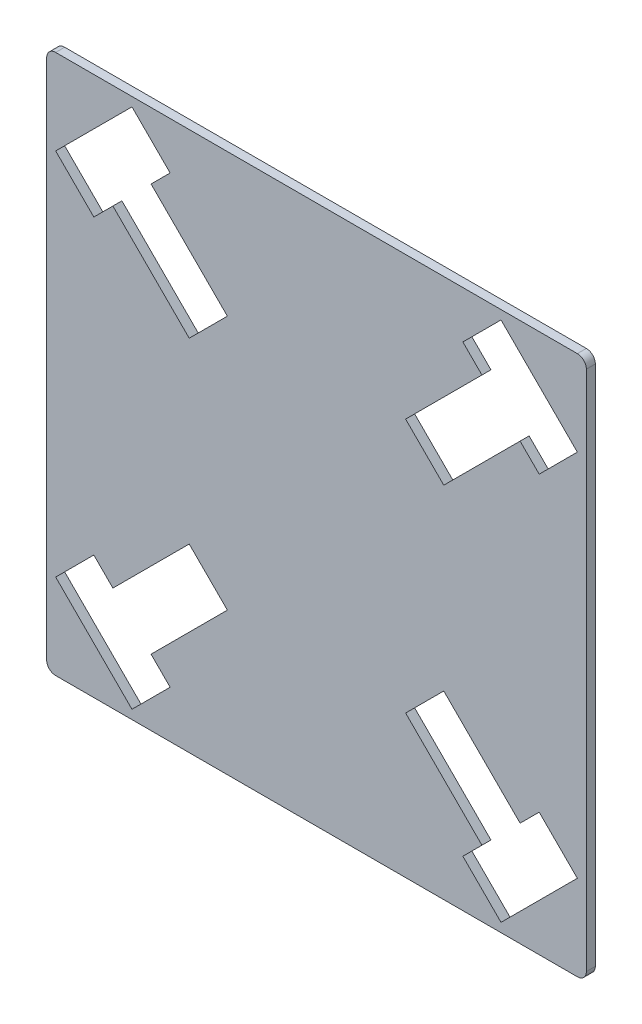
from build123d import *

# Parameters (mm, degrees)
ESQUISSE1_W             = 300
ESQUISSE1_H             = 300
BOSS_EXTRU_1_DEPTH      = 5
ENL_V_MAT_EXTRU_1_DEPTH = 5
CONG_1_R                = 5


with BuildPart() as part:
    # Esquisse1 → Boss.-Extru.1 (new body)
    with BuildSketch(Plane.XY):
        Rectangle(ESQUISSE1_W, ESQUISSE1_H)
    extrude(amount=BOSS_EXTRU_1_DEPTH)

    # Esquisse2 → Enlèv. mat.-Extru.1 (cut)
    with BuildSketch(Plane.XY):
        Polygon((-70.753787975, 49.54058454), (-49.54058454, 70.753787975), (-91.966991411, 113.180194847), (-81.360389693, 123.786796564), (-102.573593129, 145), (-145, 102.573593129), (-123.786796564, 81.360389693), (-113.180194847, 91.966991411), align=None)
        Polygon((145, 102.573593129), (123.786796564, 81.360389693), (113.180194847, 91.966991411), (70.753787975, 49.54058454), (49.54058454, 70.753787975), (91.966991411, 113.180194847), (81.360389693, 123.786796564), (102.573593129, 145), align=None)
        Polygon((-70.753787975, -49.54058454), (-49.54058454, -70.753787975), (-91.966991411, -113.180194847), (-81.360389693, -123.786796564), (-102.573593129, -145), (-145, -102.573593129), (-123.786796564, -81.360389693), (-113.180194847, -91.966991411), align=None)
        Polygon((91.966991411, -113.180194847), (81.360389693, -123.786796564), (102.573593129, -145), (145, -102.573593129), (123.786796564, -81.360389693), (113.180194847, -91.966991411), (70.753787975, -49.54058454), (49.54058454, -70.753787975), align=None)
    extrude(amount=ENL_V_MAT_EXTRU_1_DEPTH, mode=Mode.SUBTRACT)

    # Congé1
    cong_1_edges = [part.edges().sort_by_distance(p)[0] for p in [
        (-150, 150, 2.5),
        (150, 150, 2.5),
        (150, -150, 2.5),
        (-150, -150, 2.5),
    ]]
    fillet(cong_1_edges, radius=CONG_1_R)


solid = part.part
